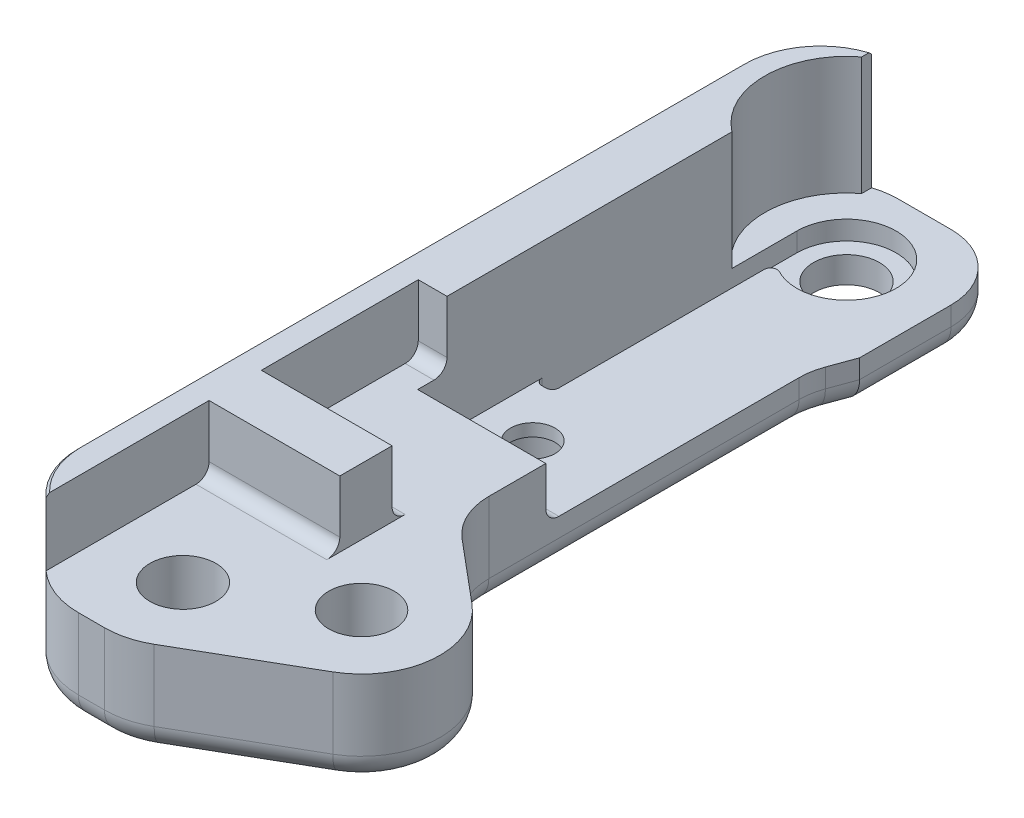
from build123d import *

# Parameters (mm, degrees)
EXTRUDE_1_DEPTH           = 7.45
EXTRUDE_2_DEPTH           = 3.45
SKETCH_3_W                = 26
SKETCH_3_H                = 4
CUT_EXTRUDE_1_DEPTH       = 9.8
SKETCH_4_W                = 4.2
SKETCH_4_H                = 62.754310162
EXTRUDE_3_DEPTH           = 5.05
CUT_EXTRUDE_2_DEPTH       = 1.45
SKETCH_6_W                = 7.8
SKETCH_6_H                = 4
EXTRUDE_4_DEPTH           = 5.05
SKETCH_7_W                = 9.8
SKETCH_7_H                = 4
CUT_EXTRUDE_3_DEPTH       = 9
CUT_EXTRUDE_4_DEPTH       = 9.05
CUT_EXTRUDE_5_REACH       = 63.678
SKETCH_10_W               = 5.05
SKETCH_10_H               = 12
SKETCH_11_W               = 14
SKETCH_11_H               = 5.05
CUT_EXTRUDE_6_DEPTH       = 2.2
HOLE_WIZARD_1_D           = 5.01
HOLE_WIZARD_2_D           = 5.05
HOLE_WIZARD_3_D           = 5.05
HOLE_WIZARD_4_D           = 3.4
HOLE_WIZARD_4_DEPTH       = 12.5
HOLE_WIZARD_4_CBORE_D     = 6
HOLE_WIZARD_4_CBORE_DEPTH = 2.5
FILLET_1_R                = 5
FILLET_2_R                = 6
CHAMFER_1_SIZE            = 0.2
FILLET_3_R                = 0.5
FILLET_4_R                = 1
FILLET_5_R                = 2


with BuildPart() as part:
    # 草图1 → 凸台-拉伸1 (new body)
    with BuildSketch(Plane(origin=(0, 7.45, 0), x_dir=(1, 0, 0), z_dir=(0, 1, 0))):
        with BuildLine():
            Line((6, 15.064661918), (6, 56.754310162))
            Line((6, 56.754310162), (-8, 56.754310162))
            Line((-8, 56.754310162), (-8, -6))
            Line((-8, -6), (1.607695155, -6))
            Line((1.607695155, -6), (11.660254038, -0.196152423))
            ThreePointArc((11.660254038, -0.196152423), (14.637422226, 4.477065544), (12.516979696, 9.596266659))
            Line((12.516979696, 9.596266659), (6, 15.064661918))
        make_face()
    extrude(amount=-EXTRUDE_1_DEPTH)

    # 草图2 → 凸台-拉伸2 (add)
    with BuildSketch(Plane.XZ):
        Polygon((6, -42.006832742), (6, -56.754310162), (7, -56.754310162), (7, -44.754310162), align=None)
    extrude(amount=-EXTRUDE_2_DEPTH)

    # 草图3 → 切除-拉伸1 (cut)
    with BuildSketch(Plane(origin=(6, 0, 0), x_dir=(0, 0, -1), z_dir=(1, 0, 0))):
        with Locations((43.754310162, 5.45)):
            Rectangle(SKETCH_3_W, SKETCH_3_H)
    extrude(amount=-CUT_EXTRUDE_1_DEPTH, mode=Mode.SUBTRACT)

    # 草图4 → 凸台-拉伸3 (add)
    with BuildSketch(Plane(origin=(0, 7.45, 0), x_dir=(-1, 0, 0), z_dir=(0, 1, 0))):
        with Locations((5.9, -25.377155081)):
            Rectangle(SKETCH_4_W, SKETCH_4_H)
    extrude(amount=EXTRUDE_3_DEPTH)

    # 草图5 → 切除-拉伸2 (cut)
    with BuildSketch(Plane(origin=(0, 3.45, 0), x_dir=(-1, 0, 0), z_dir=(0, 1, 0))):
        with BuildLine():
            Line((3.8, -30.754310162), (2.5, -30.754310162))
            Line((2.5, -30.754310162), (2.5, -46.9477369))
            ThreePointArc((2.5, -46.9477369), (2.258573906, -47.375684951), (1.76744186, -47.390361698))
            ThreePointArc((1.76744186, -47.390361698), (-3.252405192, -52.719471851), (3.8, -50.754310162))
            Line((3.8, -50.754310162), (3.8, -30.754310162))
        make_face()
    extrude(amount=-CUT_EXTRUDE_2_DEPTH, mode=Mode.SUBTRACT)

    # 草图6 → 凸台-拉伸4 (add)
    with BuildSketch(Plane(origin=(0, 7.45, 0), x_dir=(-1, 0, 0), z_dir=(0, 1, 0))):
        with Locations((-0.1, -10)):
            Rectangle(SKETCH_6_W, SKETCH_6_H)
    extrude(amount=EXTRUDE_4_DEPTH)

    # 草图7 → 切除-拉伸3 (cut)
    with BuildSketch(Plane(origin=(0, 0, -30.754310162), x_dir=(-1, 0, 0), z_dir=(0, 0, -1))):
        with Locations((-1.1, 5.45)):
            Rectangle(SKETCH_7_W, SKETCH_7_H)
    extrude(amount=-CUT_EXTRUDE_3_DEPTH, mode=Mode.SUBTRACT)

    # 草图8 → 切除-拉伸4 (cut)
    with BuildSketch(Plane(origin=(0, 12.5, 0), x_dir=(-1, 0, 0), z_dir=(0, 1, 0))):
        with BuildLine():
            Line((3.8, -45.792203754), (3.8, -55.716416569))
            ThreePointArc((3.8, -55.716416569), (6.25, -50.754310162), (3.8, -45.792203754))
        make_face()
    extrude(amount=-CUT_EXTRUDE_4_DEPTH, mode=Mode.SUBTRACT)

    # 草图10 → 切除-拉伸5 (cut, up to next)
    with BuildSketch(Plane(origin=(-6, 0, 0), x_dir=(0, -1, 0), z_dir=(-1, 0, 0)), mode=Mode.PRIVATE) as cut_extrude_5_sk1:
        with Locations((-9.975, -18)):
            Rectangle(SKETCH_10_W, SKETCH_10_H)
    cut_extrude_5_tool1 = extrude(cut_extrude_5_sk1.sketch, amount=-CUT_EXTRUDE_5_REACH, mode=Mode.PRIVATE) & part.part
    add(cut_extrude_5_tool1.solids().sort_by_distance((-6, 9.975, -18))[0], mode=Mode.SUBTRACT)

    # 草图11 → 切除-拉伸6 (cut)
    with BuildSketch(Plane(origin=(-3.8, 0, 0), x_dir=(0, 0, -1), z_dir=(1, 0, 0))):
        with Locations((1, 9.975)):
            Rectangle(SKETCH_11_W, SKETCH_11_H)
    extrude(amount=-CUT_EXTRUDE_6_DEPTH, mode=Mode.SUBTRACT)

    # 孔1 (through all)
    with Locations(Plane(origin=(0, 7.45, 0), x_dir=(1, 0, 0), z_dir=(0, 1, 0))):
        with Locations((8.660254038, 5)):
            Hole(HOLE_WIZARD_1_D / 2)

    # 孔2 (through all)
    with Locations(Plane(origin=(0, 7.45, 0), x_dir=(1, 0, 0), z_dir=(0, 1, 0))):
        with Locations((0, 0)):
            Hole(HOLE_WIZARD_2_D / 2)

    # 孔3 (through all)
    with Locations(Plane(origin=(0, 2, 0), x_dir=(1, 0, 0), z_dir=(0, 1, 0))):
        with Locations((0, 50.754310162)):
            Hole(HOLE_WIZARD_3_D / 2)

    # 孔4
    with Locations(Plane(origin=(0, 0, 0), x_dir=(-1, 0, 0), z_dir=(0, -1, 0))):
        with Locations((0, 26.754310162)):
            CounterBoreHole(HOLE_WIZARD_4_D / 2, HOLE_WIZARD_4_CBORE_D / 2, HOLE_WIZARD_4_CBORE_DEPTH, depth=HOLE_WIZARD_4_DEPTH)

    # 圆角1
    fillet_1_edges = [part.edges().sort_by_distance(p)[0] for p in [
        (6, 3.725, -15.064661918),
        (6, 1.725, -42.006832742),
        (7, 1.725, -56.754310162),
    ]]
    fillet(fillet_1_edges, radius=FILLET_1_R)

    # 圆角2
    fillet_2_edges = [part.edges().sort_by_distance(p)[0] for p in [
        (-8, 6.25, -56.754310162),
        (-8, 6.25, 6),
        (1.607695155, 3.725, 6),
    ]]
    fillet(fillet_2_edges, radius=FILLET_2_R)

    # 倒角1
    chamfer_1_edges = [part.edges().sort_by_distance(p)[0] for p in [
        (-8, 12.5, -25.377155081),
        (-7.477225575, 12.5, 2.449489743),
        (-6.837354649, 12.5, -54.303958032),
    ]]
    chamfer(chamfer_1_edges, length=CHAMFER_1_SIZE)

    # 圆角3
    fillet_3_edges = [part.edges().sort_by_distance(p)[0] for p in [
        (-2.5, 2.725, -30.754310162),
        (-3.8, 2.725, -30.754310162),
    ]]
    fillet(fillet_3_edges, radius=FILLET_3_R)

    # 圆角4
    fillet_4_edges = [part.edges().sort_by_distance(p)[0] for p in [
        (-4.9, 7.45, -24),
        (-1, 7.45, -8),
        (-1, 7.45, -12),
        (1.1, 3.45, -21.754310162),
    ]]
    fillet(fillet_4_edges, radius=FILLET_4_R)

    # 圆角5
    fillet_5_edges = [part.edges().sort_by_distance(p)[0] for p in [
        (6, 0, -29.260699024),
        (0, 0, -56.754310162),
        (7, 0, -48.254310162),
        (5.535533906, 0, -55.289844068),
        (6.075961235, 0, -41.993438727),
        (6.468461065, 0, -15.2831089),
        (-8, 0, -25.377155081),
        (7.330127019, 0, 2.696152423),
        (-1, 0, 6),
        (1.552914271, 0, 5.795554958),
        (-6.242640687, 0, 4.242640687),
        (-6.242640687, 0, -54.996950849),
        (6.650768448, 0, -43.794804359),
        (14.637422226, 0, -4.477065544),
        (10.151520824, 0, -11.581122326),
    ]]
    fillet(fillet_5_edges, radius=FILLET_5_R)


solid = part.part
